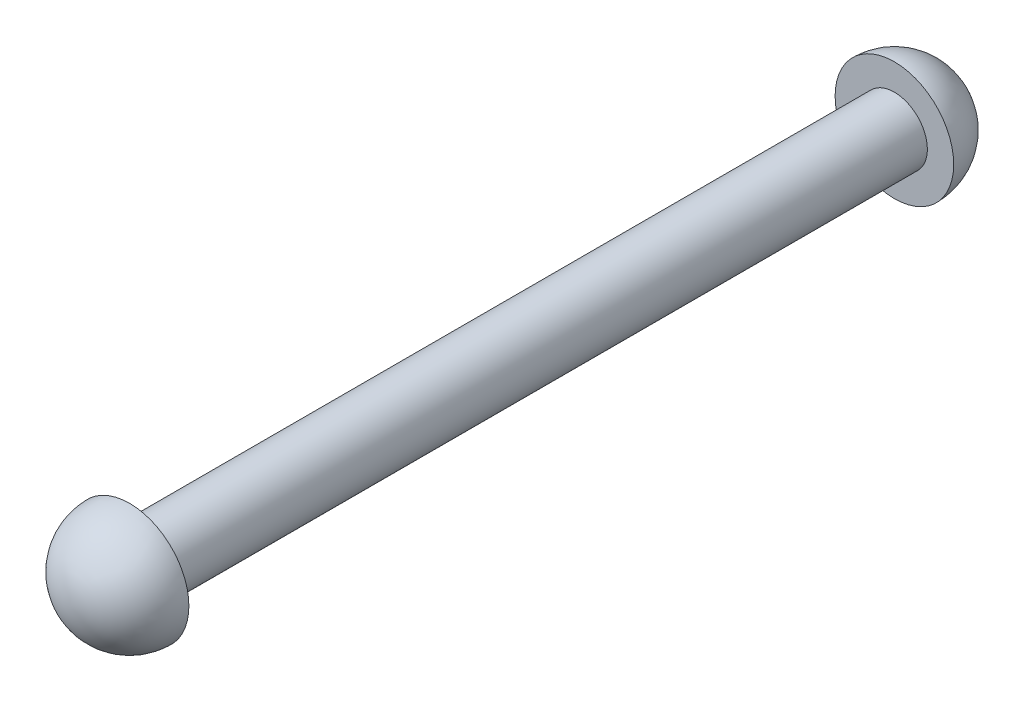
from build123d import *

# Parameters (mm, degrees)
SKETCH2_W = 68.58
SKETCH2_H = 2.956034483


with BuildPart() as part:
    # Sketch2 → Revolve1 (revolve)
    with BuildSketch(Plane(origin=(0, 0, 0), x_dir=(0, 0, -1), z_dir=(1, 0, 0))):
        with Locations((0, 1.478017242)):
            Rectangle(SKETCH2_W, SKETCH2_H)
        with BuildLine():
            ThreePointArc((-34.29, 5.316039249), (-38.049007402, 3.759007402), (-39.606039249, 0))
            Line((-39.606039249, 0), (-34.29, 0))
            Line((-34.29, 0), (-34.29, 2.956034483))
            Line((-34.29, 2.956034483), (-34.29, 5.316039249))
        make_face()
        with BuildLine():
            Line((34.29, 2.956034483), (34.29, 0))
            Line((34.29, 0), (39.606039249, 0))
            ThreePointArc((39.606039249, 0), (38.049007402, 3.759007402), (34.29, 5.316039249))
            Line((34.29, 5.316039249), (34.29, 2.956034483))
        make_face()
    revolve(axis=Axis((0, 0, 39.606039249), (0, 0, -1)))


solid = part.part
